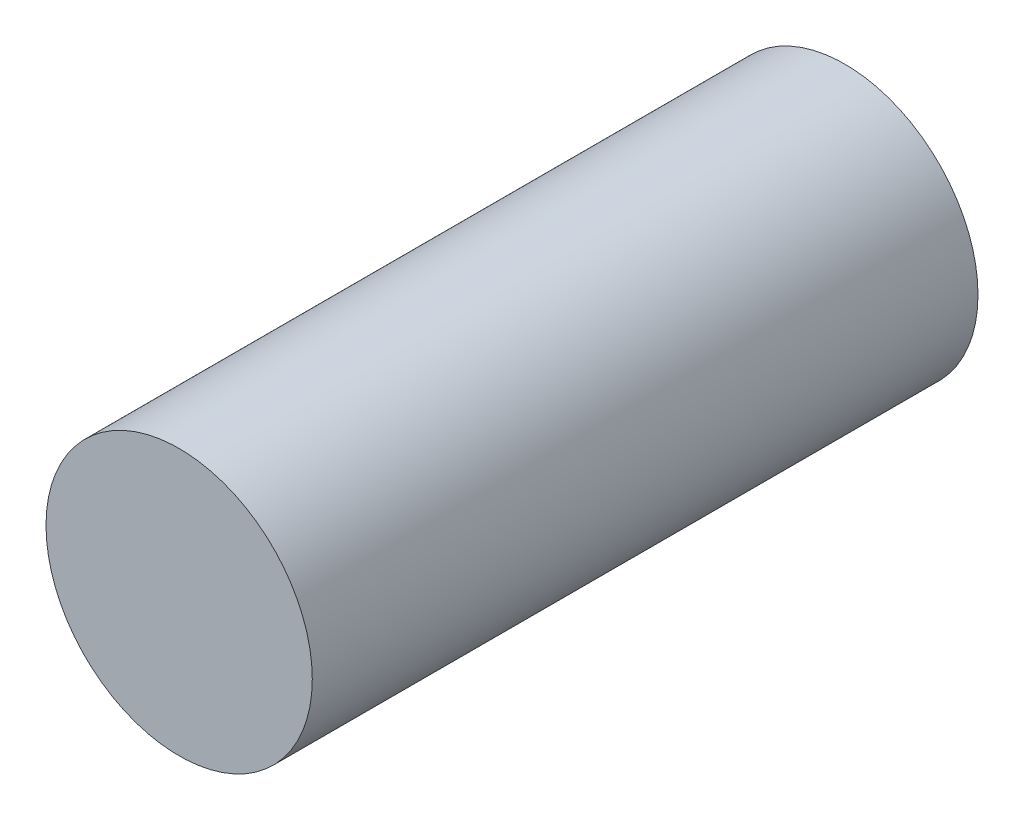
from build123d import *

# Parameters (mm, degrees)
SKETCH1_R              = 6
SNS_GOVDE_D12X30_DEPTH = 30


with BuildPart() as part:
    # Sketch1 → SNS_govde_D12x30 (new body)
    with BuildSketch(Plane.XY):
        Circle(SKETCH1_R)
    extrude(amount=-SNS_GOVDE_D12X30_DEPTH)


solid = part.part
